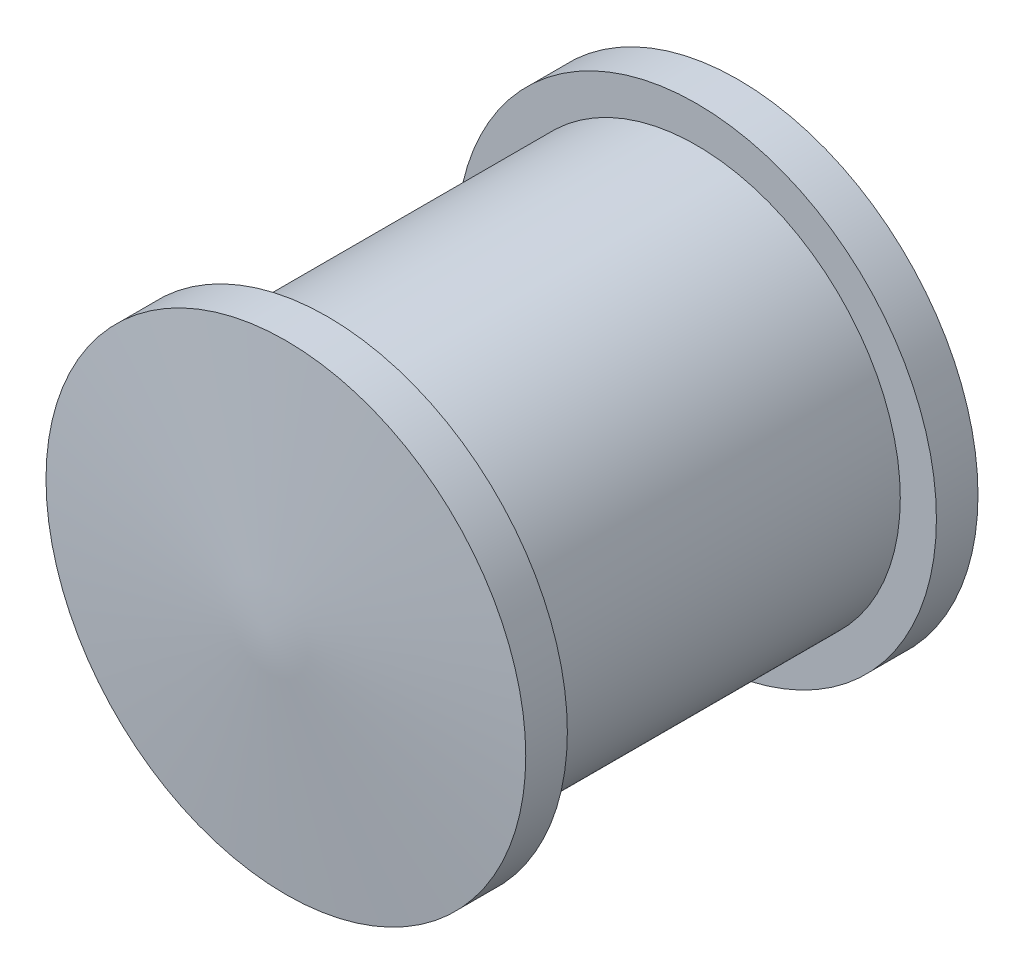
from build123d import *


with BuildPart() as part:
    # Sketch2 → Revolve1 (revolve)
    with BuildSketch(Plane(origin=(0, 0, 0), x_dir=(1, 0, 0), z_dir=(0, 1, 0))):
        Polygon((0, 0), (0, 30.8), (14.95, 29.49204448), (14.95, 26.9), (12.7, 26.9), (12.7, 3.9), (14.95, 3.9), (14.95, 1.30795552), align=None)
    revolve(axis=Axis((0, 0, 0), (0, 0, -1)))


solid = part.part
